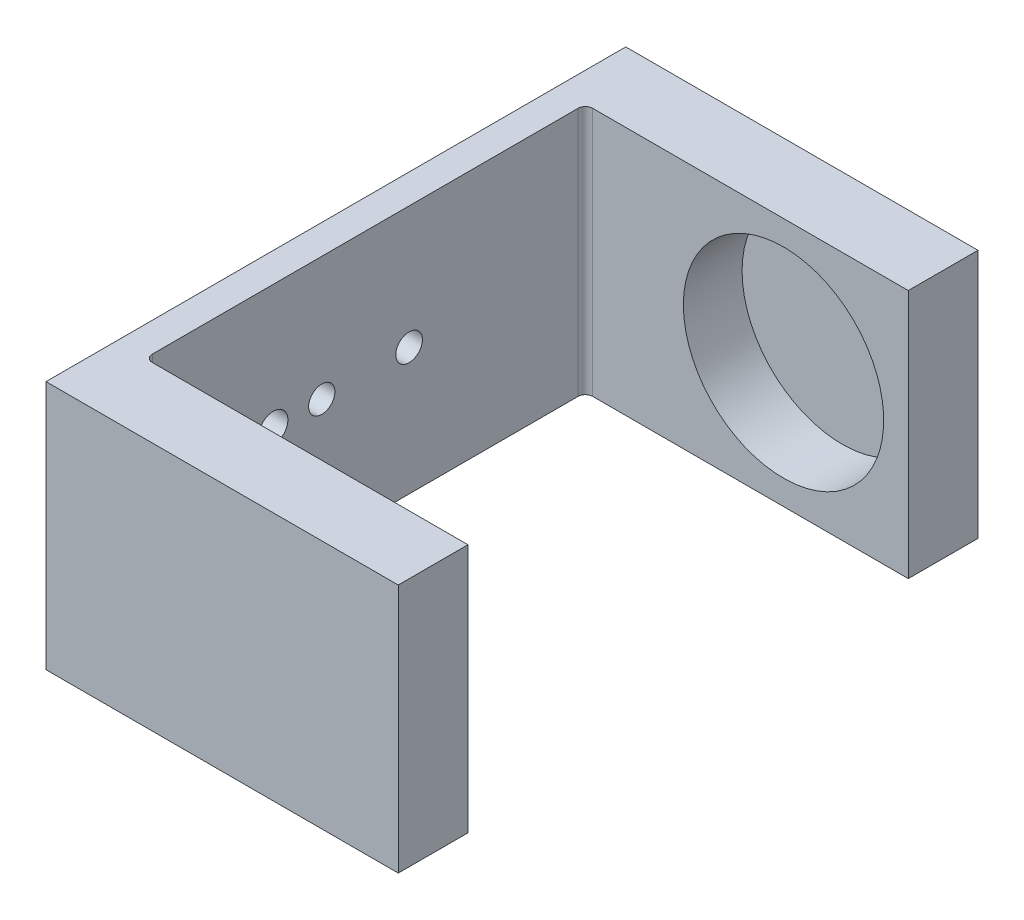
from build123d import *

# Parameters (mm, degrees)
SKETCH1_W           = 65
SKETCH1_H           = 34
SKETCH1_R           = 1.792638337
BOSS_EXTRUDE1_DEPTH = 4
SKETCH3_W           = 48
SKETCH3_H           = 34
BOSS_EXTRUDE2_DEPTH = 9.5
FILLET4_R           = 1
FILLET5_R           = 1
SKETCH5_R           = 13.65
CUT_EXTRUDE1_DEPTH  = 8
SKETCH6_R           = 1.817001486
SKETCH6_R_2         = 1.988961177
CUT_EXTRUDE2_DEPTH  = 10


with BuildPart() as part:
    # Sketch1 → Boss-Extrude1 (new body)
    with BuildSketch(Plane(origin=(0, 0, 0), x_dir=(0, 0, -1), z_dir=(1, 0, 0))):
        Rectangle(SKETCH1_W, SKETCH1_H)
        with Locations((-8.422145585, 0.13559033)):
            Circle(SKETCH1_R, mode=Mode.SUBTRACT)
    extrude(amount=-BOSS_EXTRUDE1_DEPTH)

    # Sketch3 → Boss-Extrude2 (add)
    with BuildSketch(Plane.XY.offset(32.5)):
        with Locations((20, 0)):
            Rectangle(SKETCH3_W, SKETCH3_H)
    boss_extrude2 = extrude(amount=BOSS_EXTRUDE2_DEPTH)

    # Mirror1: Boss-Extrude2 across plane
    add(boss_extrude2.mirror(Plane(origin=(0, 0, 2.5), x_dir=(1, 0, 0), z_dir=(0, 0, -1))))

    # Fillet4
    fillet4_edges = [part.edges().sort_by_distance(p)[0] for p in [
        (0, 0, 32.5),
    ]]
    fillet(fillet4_edges, radius=FILLET4_R)

    # Fillet5
    fillet5_edges = [part.edges().sort_by_distance(p)[0] for p in [
        (0, 0, -27.5),
    ]]
    fillet(fillet5_edges, radius=FILLET5_R)

    # Sketch5 → Cut-Extrude1 (cut)
    with BuildSketch(Plane(origin=(0, 0, 32.5), x_dir=(-1, 0, 0), z_dir=(0, 0, -1))):
        with Locations((-27, 0)):
            Circle(SKETCH5_R)
    cut_extrude1 = extrude(amount=-CUT_EXTRUDE1_DEPTH, mode=Mode.SUBTRACT)

    # Mirror2: Cut-Extrude1 across plane
    add(cut_extrude1.mirror(Plane(origin=(0, 0, 2.5), x_dir=(1, 0, 0), z_dir=(0, 0, -1))), mode=Mode.SUBTRACT)

    # Sketch6 → Cut-Extrude2 (cut)
    with BuildSketch(Plane.ZY.offset(4)):
        with Locations((-3.477810301, 0.314468999)):
            Circle(SKETCH6_R)
        with Locations((15.022387571, 0.02925164)):
            Circle(SKETCH6_R_2)
    extrude(amount=-CUT_EXTRUDE2_DEPTH, mode=Mode.SUBTRACT)


solid = part.part
